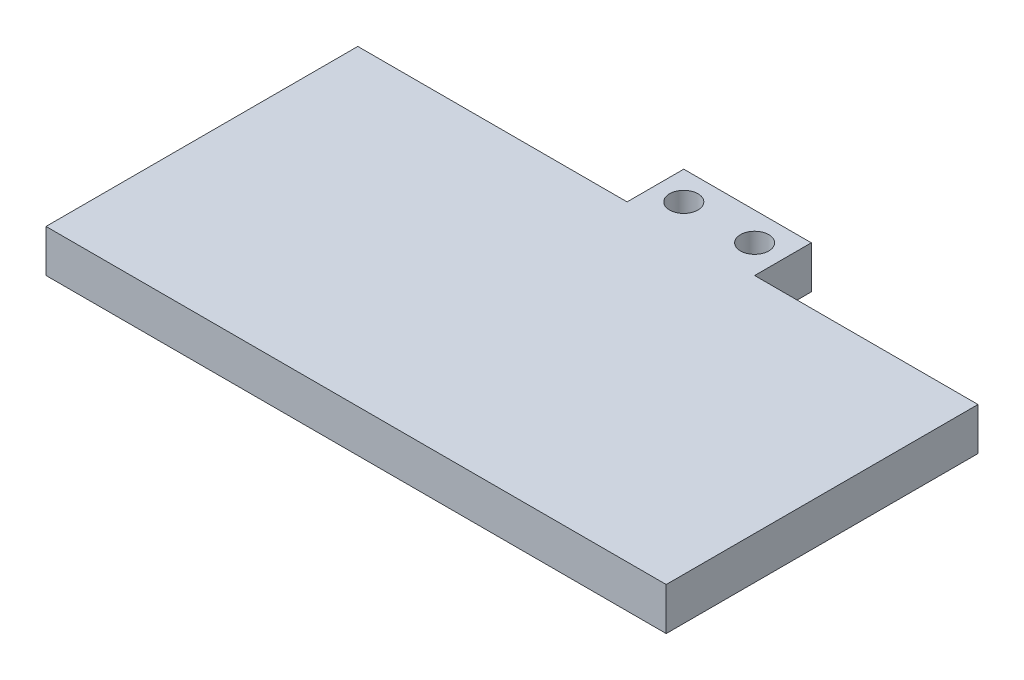
from build123d import *

# Parameters (mm, degrees)
SKETCH1_W           = 277.876
SKETCH1_H           = 139.7
BOSS_EXTRUDE2_DEPTH = 19.05
SKETCH2_W           = 57.15
SKETCH2_H           = 25.4
SKETCH2_R           = 6.35
BOSS_EXTRUDE3_DEPTH = 19.05


with BuildPart() as part:
    # Sketch1 → Boss-Extrude2 (new body)
    with BuildSketch(Plane(origin=(0, 0, 0), x_dir=(1, 0, 0), z_dir=(0, 1, 0))):
        with Locations((138.938, 69.85)):
            Rectangle(SKETCH1_W, SKETCH1_H)
    extrude(amount=BOSS_EXTRUDE2_DEPTH)

    # Sketch2 → Boss-Extrude3 (add)
    with BuildSketch(Plane(origin=(0, 19.05, 0), x_dir=(1, 0, 0), z_dir=(0, 1, 0))):
        with Locations((149.225, 152.4)):
            Rectangle(SKETCH2_W, SKETCH2_H)
        with Locations(Location((133.35, 152.4, 0), (0, 0, 270))):
            Circle(SKETCH2_R, mode=Mode.SUBTRACT)
        with Locations(Location((165.1, 152.4, 0), (0, 0, 270))):
            Circle(SKETCH2_R, mode=Mode.SUBTRACT)
    extrude(amount=-BOSS_EXTRUDE3_DEPTH)


solid = part.part
